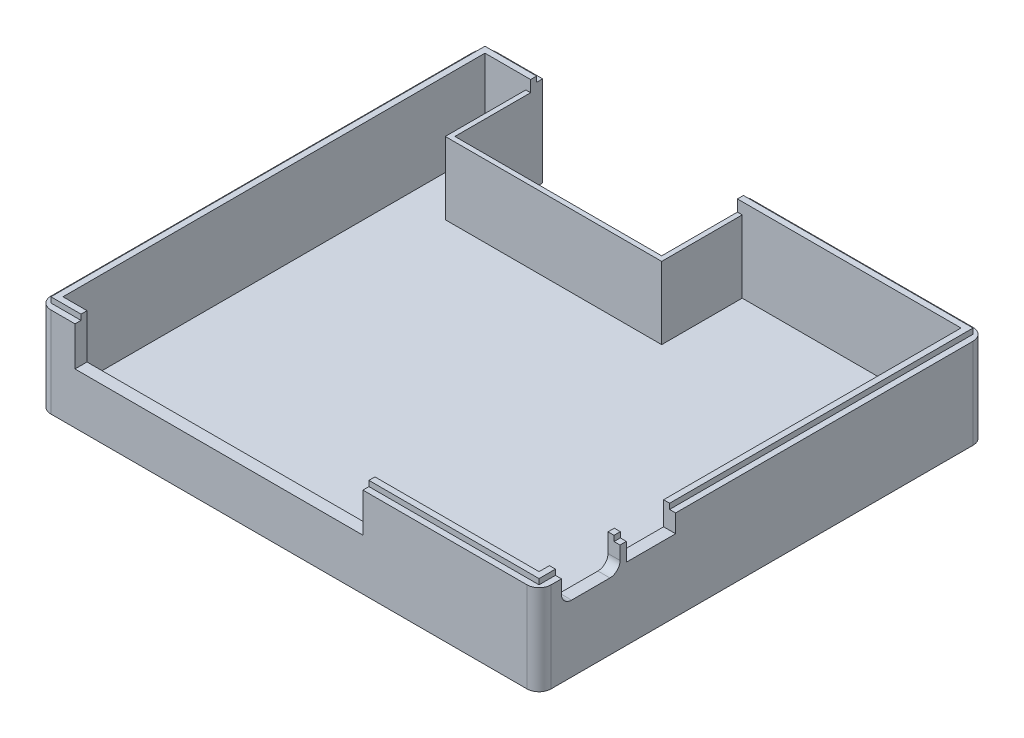
from build123d import *

# Parameters (mm, degrees)
SKETCH1_W           = 83.2
SKETCH1_H           = 74.2
BOSS_EXTRUDE1_DEPTH = 15
SHELL1_T            = -2
SKETCH2_W           = 47.9
SKETCH2_H           = 6.5
CUT_EXTRUDE1_DEPTH  = 112.175896668
CUT_EXTRUDE3_DEPTH  = 112.013873007
SKETCH4_W           = 8.2
SKETCH4_H           = 3
CUT_EXTRUDE4_DEPTH  = 112.013873007
SKETCH5_R           = 1.5
CUT_EXTRUDE5_DEPTH  = 113.235823158
SKETCH6_W           = 34.4
SKETCH6_H           = 14.6
CUT_EXTRUDE6_DEPTH  = 113.485021225
BOSS_EXTRUDE2_DEPTH = 12
SKETCH9_W           = 1
SKETCH9_H           = 1.05
EXTRUDE_THIN1_DEPTH = 0.9
FILLET1_R           = 2


with BuildPart() as part:
    # Sketch1 → Boss-Extrude1 (new body)
    with BuildSketch(Plane(origin=(0, 0, 0), x_dir=(1, 0, 0), z_dir=(0, 1, 0))):
        with Locations((41.6, 37.1)):
            Rectangle(SKETCH1_W, SKETCH1_H)
    extrude(amount=BOSS_EXTRUDE1_DEPTH)

    # Shell1
    shell1_openings = [part.faces().sort_by_distance(p)[0] for p in [
        (41.6, 15, -37.1),
    ]]
    offset(amount=SHELL1_T, openings=shell1_openings, kind=Kind.INTERSECTION)

    # Sketch2 → Cut-Extrude1 (cut, through all)
    with BuildSketch(Plane(origin=(0, 0, -2), x_dir=(-1, 0, 0), z_dir=(0, 0, -1))):
        with Locations((-29.95, 11.75)):
            Rectangle(SKETCH2_W, SKETCH2_H)
    extrude(amount=-CUT_EXTRUDE1_DEPTH, mode=Mode.SUBTRACT)

    # Sketch3 → Cut-Extrude3 (cut, through all)
    with BuildSketch(Plane.ZY.offset(-81.2)):
        with BuildLine():
            Line((-13.47, 12.775001119), (-13.47, 13.375))
            Line((-13.47, 13.375), (-13.47, 15))
            Line((-13.47, 15), (-3.73, 15))
            Line((-3.73, 15), (-3.73, 13.375000473))
            Line((-3.73, 13.375000473), (-3.73, 12.774999514))
            ThreePointArc((-3.73, 12.774999514), (-4.222062075, 11.58705914), (-5.410003665, 11.095))
            Line((-5.410003665, 11.095), (-11.79000197, 11.095))
            ThreePointArc((-11.79000197, 11.095), (-12.977940485, 11.5870617), (-13.47, 12.775001119))
        make_face()
    extrude(amount=-CUT_EXTRUDE3_DEPTH, mode=Mode.SUBTRACT)

    # Sketch4 → Cut-Extrude4 (cut, through all)
    with BuildSketch(Plane.ZY.offset(-81.2)):
        with Locations((-18.62, 13.5)):
            Rectangle(SKETCH4_W, SKETCH4_H)
    extrude(amount=-CUT_EXTRUDE4_DEPTH, mode=Mode.SUBTRACT)

    # Sketch5 → Cut-Extrude5 (cut, through all)
    with BuildSketch(Plane(origin=(0, 2, 0), x_dir=(1, 0, 0), z_dir=(0, 1, 0))):
        with Locations(Location((77.9, 27, 0), (0, 0, 270))):
            Circle(SKETCH5_R)
    extrude(amount=-CUT_EXTRUDE5_DEPTH, mode=Mode.SUBTRACT)

    # Sketch6 → Cut-Extrude6 (cut, through all)
    with BuildSketch(Plane.XZ):
        with Locations((26.8, -66.9)):
            Rectangle(SKETCH6_W, SKETCH6_H)
    extrude(amount=-CUT_EXTRUDE6_DEPTH, mode=Mode.SUBTRACT)

    # Sketch7 → Boss-Extrude2 (add)
    with BuildSketch(Plane(origin=(0, 2, 0), x_dir=(1, 0, 0), z_dir=(0, 1, 0))):
        Polygon((44, 72.2), (44, 59.6), (9.6, 59.6), (9.6, 72.2), (8.8, 72.2), (8.8, 58.8), (44.8, 58.8), (44.8, 72.2), align=None)
    extrude(amount=BOSS_EXTRUDE2_DEPTH)

    # Sketch9 → Extrude-Thin1 (add)
    with BuildSketch(Plane(origin=(0, 15, 0), x_dir=(1, 0, 0), z_dir=(0, 1, 0))):
        Polygon((9.6, 72.2), (2, 72.2), (2, 2), (6, 2), (6, 1), (1, 1), (1, 73.2), (9.6, 73.2), align=None)
        Polygon((53.9, 2), (81.2, 2), (81.2, 3.73), (82.2, 3.73), (82.2, 1), (53.9, 1), align=None)
        with Locations((81.7, 13.995)):
            Rectangle(SKETCH9_W, SKETCH9_H)
        Polygon((81.2, 22.72), (81.2, 72.2), (44, 72.2), (44, 73.2), (82.2, 73.2), (82.2, 22.72), align=None)
    extrude(amount=EXTRUDE_THIN1_DEPTH)

    # Fillet1
    fillet1_edges = [part.edges().sort_by_distance(p)[0] for p in [
        (0, 7.5, -74.2),
        (83.2, 7.5, -74.2),
        (83.2, 7.5, 0),
        (0, 7.5, 0),
    ]]
    fillet(fillet1_edges, radius=FILLET1_R)


solid = part.part
